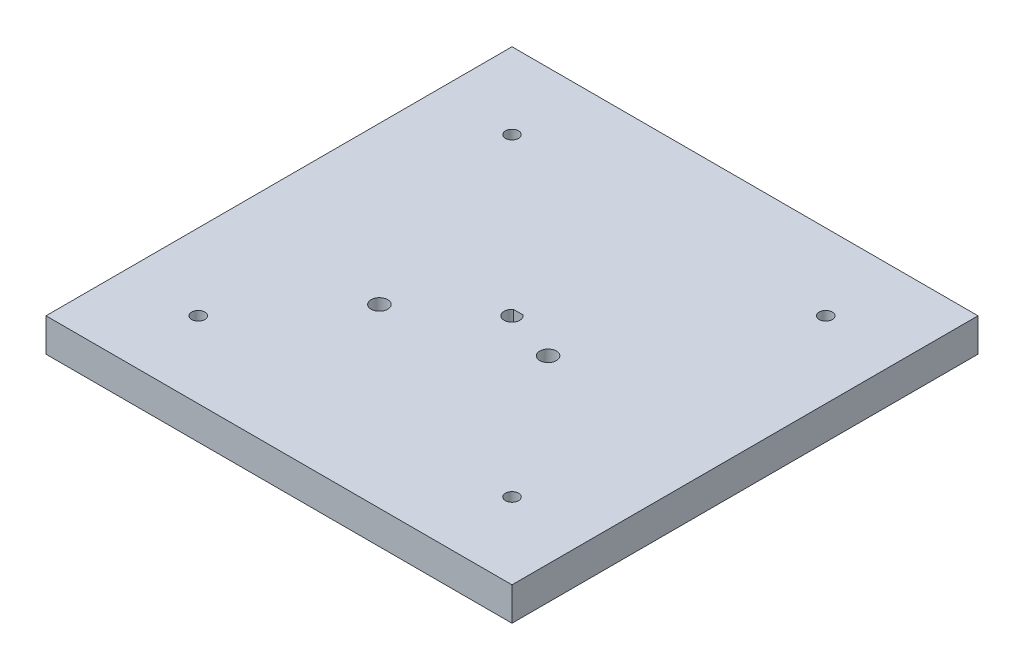
from build123d import *

# Parameters (mm, degrees)
SKETCH2_W           = 177.8
SKETCH2_H           = 177.8
BOSS_EXTRUDE1_DEPTH = 6.35
SKETCH3_R           = 2.5
CUT_EXTRUDE1_DEPTH  = 12.7
CUT_EXTRUDE2_REACH  = 128.363
SKETCH5_R           = 3.175


with BuildPart() as part:
    # Sketch2 → Boss-Extrude1 (new, symmetric)
    with BuildSketch(Plane(origin=(0, 0, 0), x_dir=(1, 0, 0), z_dir=(0, 1, 0))):
        Rectangle(SKETCH2_W, SKETCH2_H)
        with BuildLine():
            Line((-1.8, 2.4), (1.8, 2.4))
            ThreePointArc((1.8, 2.4), (0, -3), (-1.8, 2.4))
        make_face(mode=Mode.SUBTRACT)
    extrude(amount=BOSS_EXTRUDE1_DEPTH, both=True)

    # Sketch3 → Cut-Extrude1 (cut)
    with BuildSketch(Plane.XZ.offset(6.35)):
        with Locations(Location((-59.856589027, -59.856589027, 0), (0, 0, 270))):
            Circle(SKETCH3_R)
        with Locations(Location((59.856589027, -59.856589027, 0), (0, 0, 270))):
            Circle(SKETCH3_R)
        with Locations(Location((59.856589027, 59.856589027, 0), (0, 0, 270))):
            Circle(SKETCH3_R)
        with Locations(Location((-59.856589027, 59.856589027, 0), (0, 0, 270))):
            Circle(SKETCH3_R)
    extrude(amount=-CUT_EXTRUDE1_DEPTH, mode=Mode.SUBTRACT)

    # Sketch5 → Cut-Extrude2 (cut, up to next)
    with BuildSketch(Plane(origin=(0, 6.35, 0), x_dir=(1, 0, 0), z_dir=(0, 1, 0)), mode=Mode.PRIVATE) as cut_extrude2_sk1:
        with Locations(Location((20.113342208, -6.35, 0), (0, 0, 270))):
            Circle(SKETCH5_R)
    cut_extrude2_tool1 = extrude(cut_extrude2_sk1.sketch, amount=-CUT_EXTRUDE2_REACH, mode=Mode.PRIVATE) & part.part
    # Sketch5 → Cut-Extrude2 (cut, up to next)
    with BuildSketch(Plane(origin=(0, 6.35, 0), x_dir=(1, 0, 0), z_dir=(0, 1, 0)), mode=Mode.PRIVATE) as cut_extrude2_sk2:
        with Locations(Location((-29.035657792, -21.552614691, 0), (0, 0, 270))):
            Circle(SKETCH5_R)
    cut_extrude2_tool2 = extrude(cut_extrude2_sk2.sketch, amount=-CUT_EXTRUDE2_REACH, mode=Mode.PRIVATE) & part.part
    add(cut_extrude2_tool1.solids().sort_by_distance((20.113342, 6.35, 6.35))[0], mode=Mode.SUBTRACT)
    add(cut_extrude2_tool2.solids().sort_by_distance((-29.035658, 6.35, 21.552615))[0], mode=Mode.SUBTRACT)


solid = part.part
